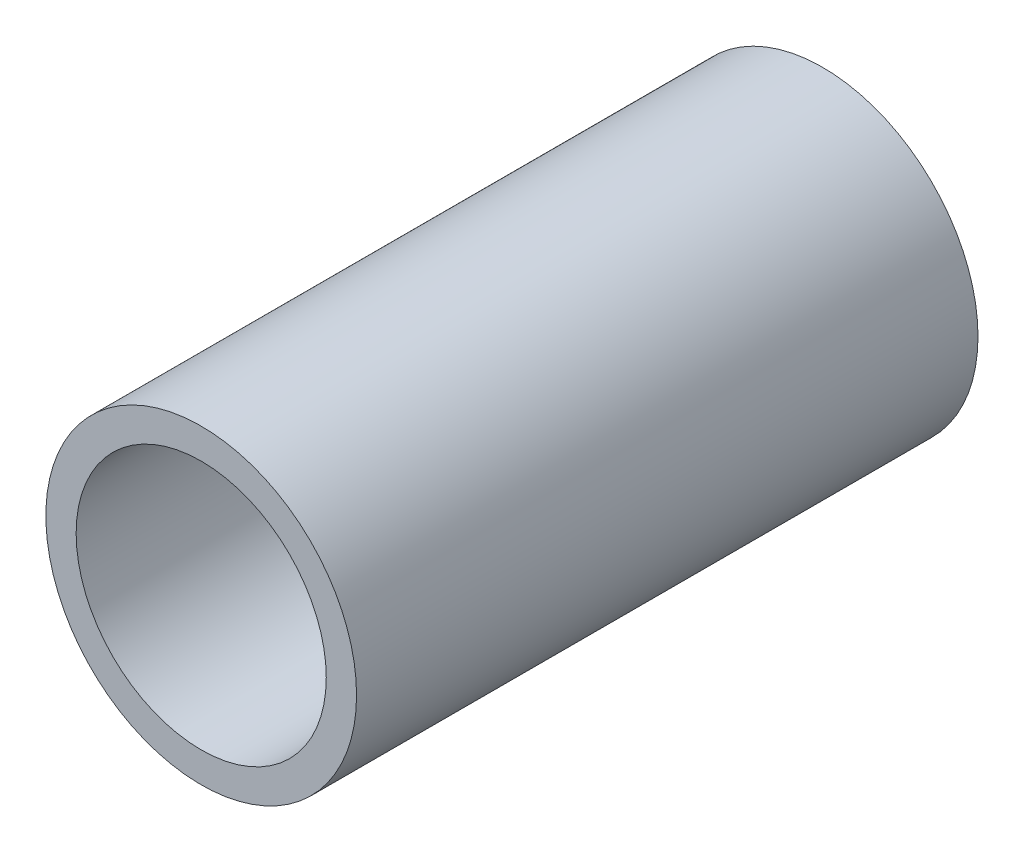
from build123d import *

# Parameters (mm, degrees)
SKETCH1_R           = 5
SKETCH1_R_2         = 4.025
BOSS_EXTRUDE1_DEPTH = 20


with BuildPart() as part:
    # Sketch1 → Boss-Extrude1 (new body)
    with BuildSketch(Plane.XY):
        Circle(SKETCH1_R)
        Circle(SKETCH1_R_2, mode=Mode.SUBTRACT)
    extrude(amount=BOSS_EXTRUDE1_DEPTH)


solid = part.part
